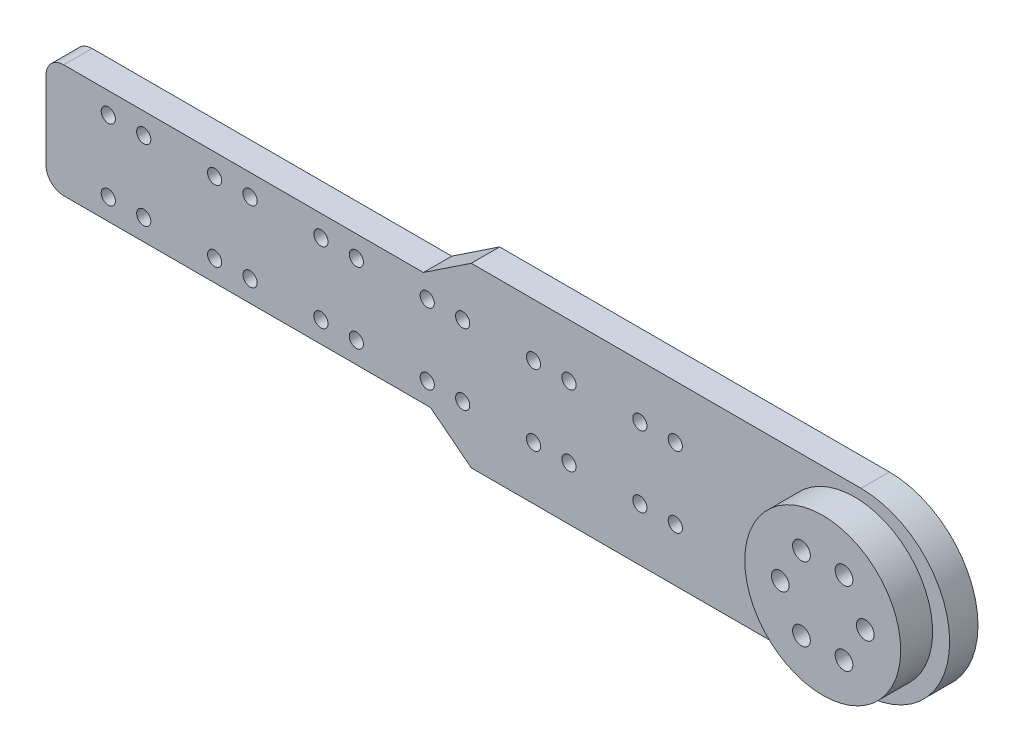
from build123d import *

# Parameters (mm, degrees)
SKETCH_1_R          = 2
EXTRUDE_1_DEPTH     = 8
FILLET_1_R          = 10
SKETCH_2_R          = 22
SKETCH_2_R_2        = 2.5
EXTRUDE_3_DEPTH     = 9
MM_1_D              = 5
SKETCH_11_W         = 120
SKETCH_11_H         = 9.00000035
CUT_EXTRUDE_2_DEPTH = 143.499121284
FILLET_5_R          = 5
FILLET_8_R          = 5
RIB_9_REACH         = 145.227
SKETCH_14_WALL_W    = 304.68091252
SKETCH_14_WALL_H    = 8
RIB_26_REACH        = 144.499
SKETCH_16_WALL_W    = 14.607309972
SKETCH_16_WALL_H    = 8


with BuildPart() as part:
    # 草图1 → 凸台-拉伸1 (new body)
    with BuildSketch(Plane.XY):
        with BuildLine():
            Line((-114.99999839, -24.99999965), (114.99999517, -24.99999965))
            ThreePointArc((114.99999517, -24.99999965), (139.99999839, -2.87e-06), (115.00000161, 25.00000035))
            Line((115.00000161, 25.00000035), (-114.99999839, 25.00000035))
            Line((-114.99999839, 25.00000035), (-114.99999839, -24.99999965))
        make_face()
        with Locations((-67.422337314, 10.00000035)):
            Circle(SKETCH_1_R, mode=Mode.SUBTRACT)
        with Locations(Location((-67.422337314, -9.99999965, 0), (0, 0, 180))):
            Circle(SKETCH_1_R, mode=Mode.SUBTRACT)
        with Locations((-57.422337314, 10.00000035)):
            Circle(SKETCH_1_R, mode=Mode.SUBTRACT)
        with Locations(Location((-57.422337314, -9.99999965, 0), (0, 0, 180))):
            Circle(SKETCH_1_R, mode=Mode.SUBTRACT)
        with Locations((-37.422337314, 10.00000035)):
            Circle(SKETCH_1_R, mode=Mode.SUBTRACT)
        with Locations((-27.422337314, 10.00000035)):
            Circle(SKETCH_1_R, mode=Mode.SUBTRACT)
        with Locations(Location((-37.422337314, -9.99999965, 0), (0, 0, 180))):
            Circle(SKETCH_1_R, mode=Mode.SUBTRACT)
        with Locations(Location((-27.422337314, -9.99999965, 0), (0, 0, 180))):
            Circle(SKETCH_1_R, mode=Mode.SUBTRACT)
        with Locations((-7.422337314, 10.00000035)):
            Circle(SKETCH_1_R, mode=Mode.SUBTRACT)
        with Locations((2.577662686, 10.00000035)):
            Circle(SKETCH_1_R, mode=Mode.SUBTRACT)
        with Locations(Location((-7.422337314, -9.99999965, 0), (0, 0, 180))):
            Circle(SKETCH_1_R, mode=Mode.SUBTRACT)
        with Locations(Location((2.577662686, -9.99999965, 0), (0, 0, 180))):
            Circle(SKETCH_1_R, mode=Mode.SUBTRACT)
        with Locations((22.577662686, 10.00000035)):
            Circle(SKETCH_1_R, mode=Mode.SUBTRACT)
        with Locations((32.577662686, 10.00000035)):
            Circle(SKETCH_1_R, mode=Mode.SUBTRACT)
        with Locations(Location((22.577662686, -9.99999965, 0), (0, 0, 180))):
            Circle(SKETCH_1_R, mode=Mode.SUBTRACT)
        with Locations(Location((32.577662686, -9.99999965, 0), (0, 0, 180))):
            Circle(SKETCH_1_R, mode=Mode.SUBTRACT)
        with Locations((-97.422337314, 10.00000035)):
            Circle(SKETCH_1_R, mode=Mode.SUBTRACT)
        with Locations(Location((-97.422337314, -9.99999965, 0), (0, 0, 180))):
            Circle(SKETCH_1_R, mode=Mode.SUBTRACT)
        with Locations((-87.422337314, 10.00000035)):
            Circle(SKETCH_1_R, mode=Mode.SUBTRACT)
        with Locations(Location((-87.422337314, -9.99999965, 0), (0, 0, 180))):
            Circle(SKETCH_1_R, mode=Mode.SUBTRACT)
        with Locations((52.577662686, 10.00000035)):
            Circle(SKETCH_1_R, mode=Mode.SUBTRACT)
        with Locations((62.577662686, 10.00000035)):
            Circle(SKETCH_1_R, mode=Mode.SUBTRACT)
        with Locations(Location((52.577662686, -9.99999965, 0), (0, 0, 180))):
            Circle(SKETCH_1_R, mode=Mode.SUBTRACT)
        with Locations(Location((62.577662686, -9.99999965, 0), (0, 0, 180))):
            Circle(SKETCH_1_R, mode=Mode.SUBTRACT)
    extrude(amount=EXTRUDE_1_DEPTH)

    # 圆角1
    fillet_1_edges = [part.edges().sort_by_distance(p)[0] for p in [
        (-114.99999839, -24.99999965, 4),
        (-114.99999839, 25.00000035, 4),
    ]]
    fillet(fillet_1_edges, radius=FILLET_1_R)

    # 草图2 → 凸台-拉伸3 (add)
    with BuildSketch(Plane.XY.offset(8)):
        with Locations(Location((113.184869064, 3.5e-07, 0), (0, 0, 180))):
            Circle(SKETCH_2_R)
        with Locations((119.184869064, -10.392304495)):
            Circle(SKETCH_2_R_2, mode=Mode.SUBTRACT)
        with Locations((107.184869064, -10.392304495)):
            Circle(SKETCH_2_R_2, mode=Mode.SUBTRACT)
        with Locations((101.184869064, 3.5e-07)):
            Circle(SKETCH_2_R_2, mode=Mode.SUBTRACT)
        with Locations((107.184869064, 10.392305195)):
            Circle(SKETCH_2_R_2, mode=Mode.SUBTRACT)
        with Locations((119.184869064, 10.392305195)):
            Circle(SKETCH_2_R_2, mode=Mode.SUBTRACT)
        with Locations((125.184869064, 3.5e-07)):
            Circle(SKETCH_2_R_2, mode=Mode.SUBTRACT)
    extrude(amount=EXTRUDE_3_DEPTH)

    # 大小mm 暗销孔1 (through all)
    with Locations(Plane.XY.offset(8)):
        with Locations((119.184869064, -10.392304495), (107.184869064, -10.392304495), (101.184869064, 3.5e-07), (107.184869064, 10.392305195), (119.184869064, 10.392305195), (125.184869064, 3.5e-07)):
            Hole(MM_1_D / 2)

    # 草图11 → 切除-拉伸2 (cut, through all)
    with BuildSketch(Plane.XY.offset(8)):
        with Locations((-54.99999839, 20.500000175)):
            Rectangle(SKETCH_11_W, SKETCH_11_H)
        with Locations((-54.99999839, -20.500000175)):
            Rectangle(SKETCH_11_W, SKETCH_11_H)
    extrude(amount=-CUT_EXTRUDE_2_DEPTH, mode=Mode.SUBTRACT)

    # 圆角5
    fillet_5_edges = [part.edges().sort_by_distance(p)[0] for p in [
        (-114.949872796, 16, 4),
    ]]
    fillet(fillet_5_edges, radius=FILLET_5_R)

    # 圆角8
    fillet_8_edges = [part.edges().sort_by_distance(p)[0] for p in [
        (-114.949872726, -16, 4),
    ]]
    fillet(fillet_8_edges, radius=FILLET_8_R)

    # 草图14 wall → 筋9 (add, up to next)
    with BuildSketch(Plane(origin=(-1.751049722, 20.500000175, 0), x_dir=(-0.832090153066, -0.554640403479, 0), z_dir=(-0.554640403479, 0.832090153066, 0)), mode=Mode.PRIVATE) as rib_9_sk1:
        with Locations((0, 4)):
            Rectangle(SKETCH_14_WALL_W, SKETCH_14_WALL_H)
    rib_9_tool1 = extrude(rib_9_sk1.sketch, amount=-RIB_9_REACH, mode=Mode.PRIVATE) - part.part
    add(rib_9_tool1.solids().sort_by_distance((-1.751049722, 20.500000175, 0))[0])

    # 草图16 wall → 筋26 (add, up to next)
    with BuildSketch(Plane(origin=(-0.75268251, -20.500000175, 8), x_dir=(-0.787644560259, 0.616129894336, 0), z_dir=(-0.616129894336, -0.787644560259, 0)), mode=Mode.PRIVATE) as rib_26_sk1:
        with Locations((0, 4)):
            Rectangle(SKETCH_16_WALL_W, SKETCH_16_WALL_H)
    rib_26_tool1 = extrude(rib_26_sk1.sketch, amount=-RIB_26_REACH, mode=Mode.PRIVATE) - part.part
    add(rib_26_tool1.solids().sort_by_distance((-0.75268251, -20.500000175, 8))[0])


solid = part.part
